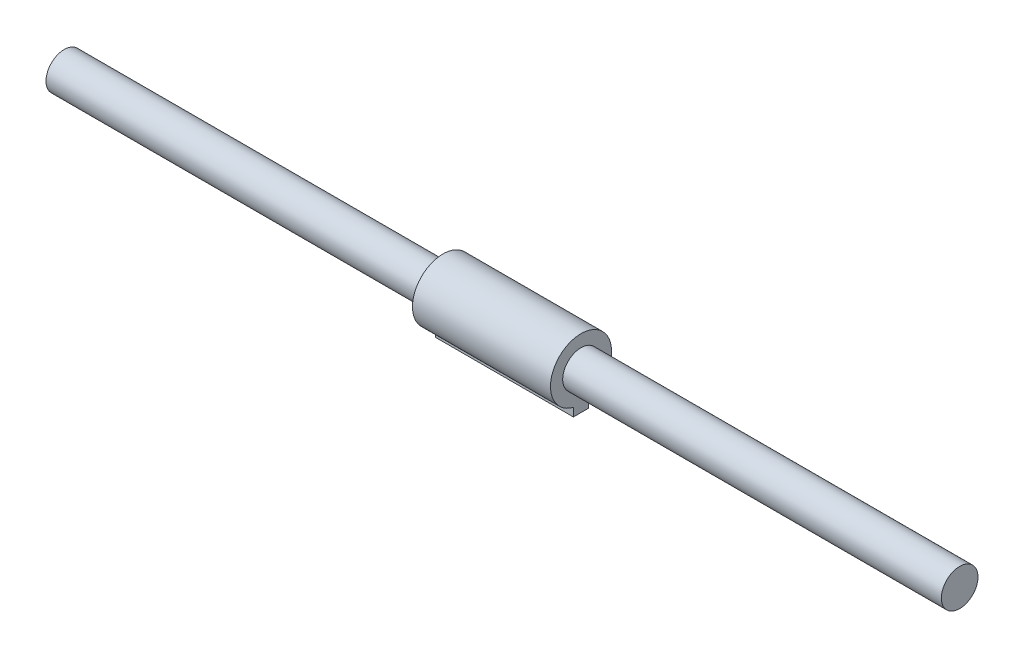
from build123d import *

# Parameters (mm, degrees)
BOSS_EXTRUDE1_DEPTH = 28.702
SKETCH3_R           = 3.81
BOSS_EXTRUDE3_DEPTH = 78.74
BOSS_EXTRUDE4_START = 78.74
SKETCH4_R           = 3.81
BOSS_EXTRUDE4_DEPTH = 78.74


with BuildPart() as part:
    # Sketch1 → Boss-Extrude1 (new body)
    with BuildSketch(Plane(origin=(0, 0, 0), x_dir=(0, 0, -1), z_dir=(1, 0, 0))):
        with BuildLine():
            Line((1.5875, -6.148361062), (1.5875, -7.873021062))
            Line((1.5875, -7.873021062), (-1.5875, -7.873021062))
            Line((-1.5875, -7.873021062), (-1.5875, -6.148361062))
            ThreePointArc((-1.5875, -6.148361062), (0, 6.35), (1.5875, -6.148361062))
        make_face()
    extrude(amount=BOSS_EXTRUDE1_DEPTH)

    # Sketch3 → Boss-Extrude3 (add)
    with BuildSketch(Plane(origin=(28.702, 0, 0), x_dir=(0, 0, -1), z_dir=(1, 0, 0))):
        Circle(SKETCH3_R)
    extrude(amount=BOSS_EXTRUDE3_DEPTH)

    # Sketch4 → Boss-Extrude4 (add)
    with BuildSketch(Plane.ZY.offset(BOSS_EXTRUDE4_START)):
        with Locations(Location((0, 0, 0), (0, 0, 180))):
            Circle(SKETCH4_R)
    extrude(amount=-BOSS_EXTRUDE4_DEPTH)


solid = part.part
